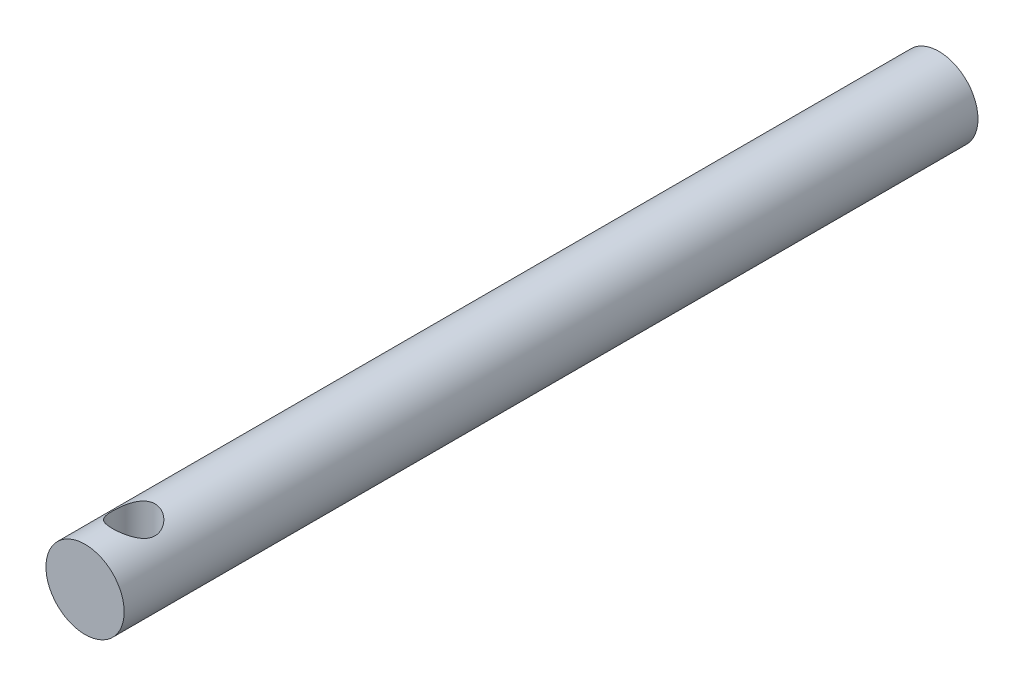
from build123d import *

# Parameters (mm, degrees)
ESQUISSE1_R             = 2.75
BOSS_EXTRU_1_DEPTH      = 60
ESQUISSE3_R             = 1.5
ENL_V_MAT_EXTRU_1_DEPTH = 3
ENL_V_START             = -3
ESQUISSE4_R             = 1.5
ENL_V_MAT_EXTRU_2_DEPTH = 3


with BuildPart() as part:
    # Esquisse1 → Boss.-Extru.1 (new body)
    with BuildSketch(Plane.XY):
        Circle(ESQUISSE1_R)
    extrude(amount=BOSS_EXTRU_1_DEPTH)

    # Esquisse3 → Enlèv. mat.-Extru.1 (cut)
    with BuildSketch(Plane(origin=(0, 0, 0), x_dir=(1, 0, 0), z_dir=(0, 1, 0))):
        with Locations(Location((0, -56.58327063, 0), (0, 0, 270))):
            Circle(ESQUISSE3_R)
    extrude(amount=-ENL_V_MAT_EXTRU_1_DEPTH, mode=Mode.SUBTRACT)

    # Esquisse4 → Enlèv. mat.-Extru.2 (cut)
    with BuildSketch(Plane.XZ.offset(ENL_V_START)):
        with Locations(Location((0, 56.58327063, 0), (0, 0, 90))):
            Circle(ESQUISSE4_R)
    extrude(amount=ENL_V_MAT_EXTRU_2_DEPTH, mode=Mode.SUBTRACT)


solid = part.part
